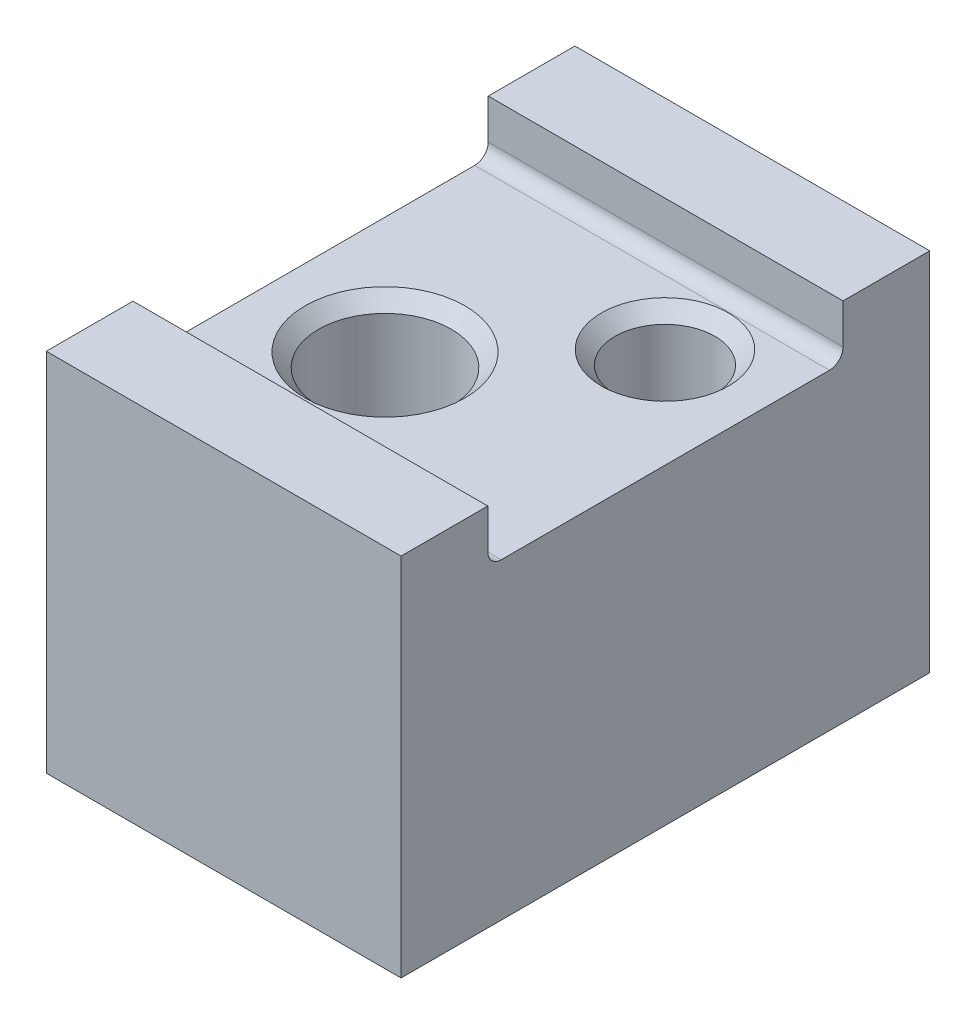
from build123d import *

# Parameters (mm, degrees)
SKETCH1_W               = 14.3002
SKETCH1_H               = 15.875
BOSS_EXTRUDE1_DEPTH     = 10.9728
CUT_EXTRUDE1_DEPTH      = 20.695226989
CUT_EXTRUDE1_DEPTH_BACK = 20.695226989
CUT_EXTRUDE2_DEPTH      = 16.314378084
CUT_EXTRUDE2_DEPTH_BACK = 16.314378084
SKETCH6_W               = 3.646294
SKETCH6_H               = 15.875


with BuildPart() as part:
    # Sketch1 → Boss-Extrude1 (new body)
    with BuildSketch(Plane(origin=(0, 0, 0), x_dir=(1, 0, 0), z_dir=(0, 1, 0))):
        Rectangle(SKETCH1_W, SKETCH1_H)
    extrude(amount=BOSS_EXTRUDE1_DEPTH)

    # Sketch5 → Cut-Extrude1 (cut, two sides: drawn at the far end of the back side and taken through both)
    with BuildSketch(Plane(origin=(7.1501, 0, 0), x_dir=(0, 0, -1), z_dir=(1, 0, 0)).offset(-CUT_EXTRUDE1_DEPTH_BACK)):
        with BuildLine():
            Line((-5.334, 10.9728), (5.334, 10.9728))
            Line((5.334, 10.9728), (5.334, 9.779))
            ThreePointArc((5.334, 9.779), (5.214968196, 9.491631804), (4.9276, 9.3726))
            Line((4.9276, 9.3726), (-4.9276, 9.3726))
            ThreePointArc((-4.9276, 9.3726), (-5.214968196, 9.491631804), (-5.334, 9.779))
            Line((-5.334, 9.779), (-5.334, 10.9728))
        make_face()
    extrude(amount=CUT_EXTRUDE1_DEPTH + CUT_EXTRUDE1_DEPTH_BACK, mode=Mode.SUBTRACT)

    # Sketch3 → Cut-Revolve1 (revolve, cut)
    with BuildSketch(Plane(origin=(0, 0, 0), x_dir=(0, 0, -1), z_dir=(1, 0, 0)), mode=Mode.PRIVATE) as cut_revolve1_sk:
        Polygon((-3.6703, 9.3726), (-3.2639, 8.9662), (-3.2639, 2.2098), (-2.7686, 1.7145), (-2.7686, 0), (-1.27, 0), (-1.27, 9.3726), align=None)
    revolve(cut_revolve1_sk.sketch.rotate(Axis((0, 0, 1.27), (0, 1, 0)), 180), axis=Axis((0, 0, 1.27), (0, 1, 0)), mode=Mode.SUBTRACT)

    # Sketch4 → Cut-Revolve2 (revolve, cut)
    with BuildSketch(Plane(origin=(4.1402, 0, 0), x_dir=(0, 0, -1), z_dir=(1, 0, 0)), mode=Mode.PRIVATE) as cut_revolve2_sk:
        Polygon((2.9972, 10.9728), (2.9972, 0), (4.4972, 0), (4.4972, 8.9662), (4.9036, 9.3726), (4.9036, 10.9728), align=None)
    revolve(cut_revolve2_sk.sketch.rotate(Axis((4.1402, 10.9728, -2.9972), (0, -1, 0)), 180), axis=Axis((4.1402, 10.9728, -2.9972), (0, -1, 0)), mode=Mode.SUBTRACT)

    # Sketch6 → Cut-Extrude2 (cut, two sides: drawn at the far end of the back side and taken through both)
    with BuildSketch(Plane(origin=(0, 10.9728, 0), x_dir=(1, 0, 0), z_dir=(0, 1, 0)).offset(-CUT_EXTRUDE2_DEPTH_BACK)):
        with Locations((-5.326953, 0)):
            Rectangle(SKETCH6_W, SKETCH6_H)
    extrude(amount=CUT_EXTRUDE2_DEPTH + CUT_EXTRUDE2_DEPTH_BACK, mode=Mode.SUBTRACT)


solid = part.part
